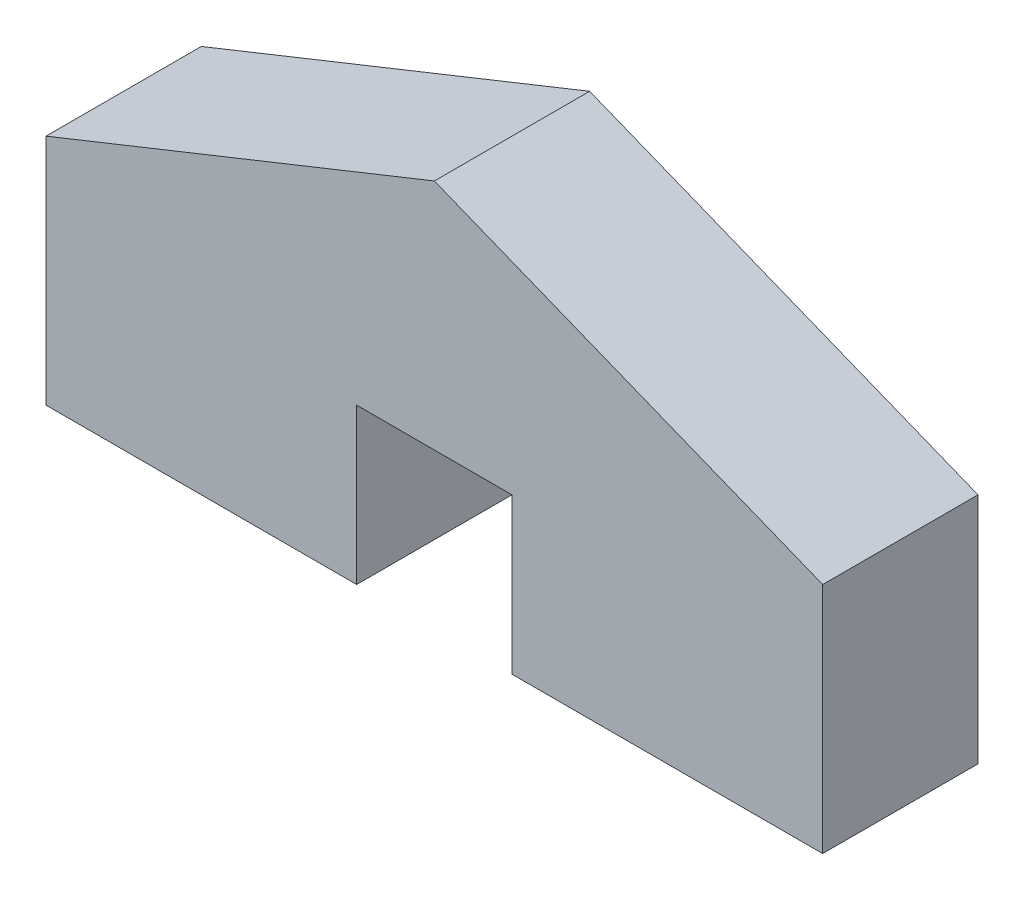
from build123d import *

# Parameters (mm, degrees)
BOSS_EXTRUDE1_DEPTH = 20
SKETCH2_W           = 20
SKETCH2_H           = 20
CUT_EXTRUDE1_DEPTH  = 74.484692283


with BuildPart() as part:
    # Sketch1 → Boss-Extrude1 (new body)
    with BuildSketch(Plane.XY):
        Polygon((50, 0), (-50, 0), (-50, 30), (0, 50), (50, 30), align=None)
    extrude(amount=BOSS_EXTRUDE1_DEPTH)

    # Sketch2 → Cut-Extrude1 (cut, through all)
    with BuildSketch(Plane.XY.offset(20)):
        with Locations((0, 10)):
            Rectangle(SKETCH2_W, SKETCH2_H)
    extrude(amount=-CUT_EXTRUDE1_DEPTH, mode=Mode.SUBTRACT)


solid = part.part
